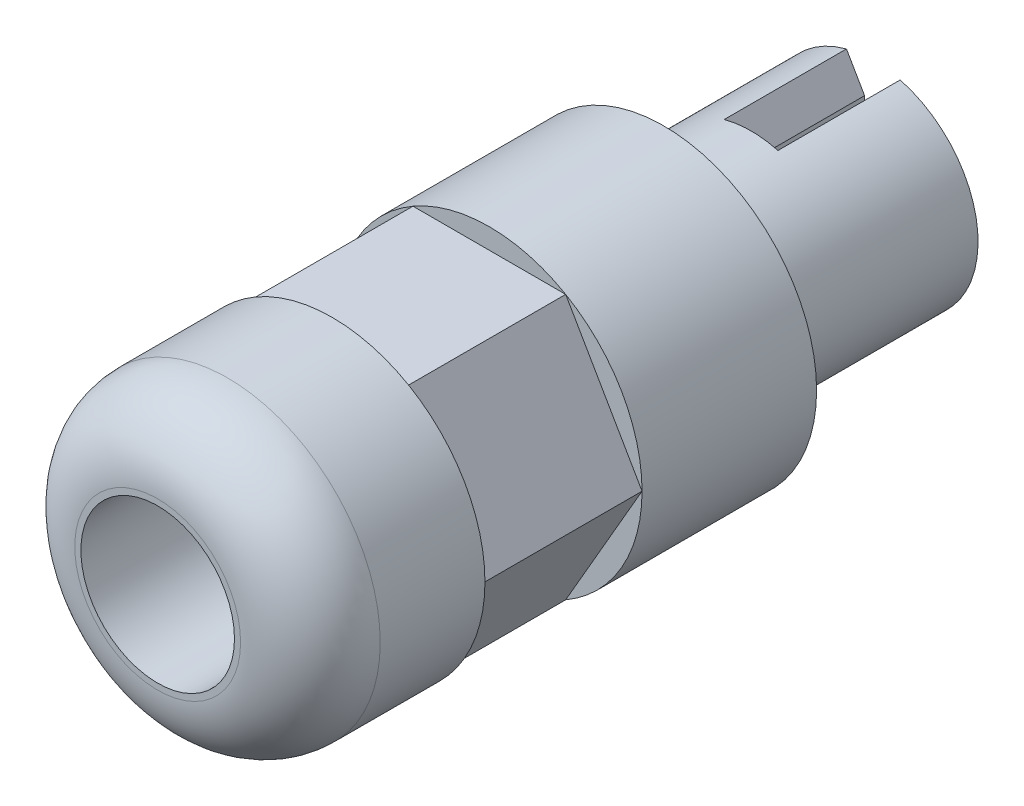
from build123d import *

# Parameters (mm, degrees)
SKETCH1_R           = 6
BOSS_EXTRUDE1_DEPTH = 12
SKETCH2_R           = 8.75
BOSS_EXTRUDE2_DEPTH = 10
BOSS_EXTRUDE3_DEPTH = 9
SKETCH4_R           = 8.75
BOSS_EXTRUDE4_DEPTH = 10
FILLET1_R           = 4
SKETCH5_R           = 4.4
CUT_EXTRUDE1_DEPTH  = 20
CUT_EXTRUDE2_DEPTH  = 7
SKETCH7_R           = 1
CUT_EXTRUDE3_DEPTH  = 7
CHAMFER1_SIZE       = 0.2


with BuildPart() as part:
    # Sketch1 → Boss-Extrude1 (new body)
    with BuildSketch(Plane.XY):
        Circle(SKETCH1_R)
    extrude(amount=BOSS_EXTRUDE1_DEPTH)

    # Sketch2 → Boss-Extrude2 (add)
    with BuildSketch(Plane.XY.offset(12)):
        Circle(SKETCH2_R)
    extrude(amount=BOSS_EXTRUDE2_DEPTH)

    # Sketch3 → Boss-Extrude3 (add)
    with BuildSketch(Plane.XY.offset(22)):
        Polygon((4.375, 7.577722283), (-4.375, 7.577722283), (-8.75, 0), (-4.375, -7.577722283), (4.375, -7.577722283), (8.75, 0), align=None)
    extrude(amount=BOSS_EXTRUDE3_DEPTH)

    # Sketch4 → Boss-Extrude4 (add)
    with BuildSketch(Plane.XY.offset(31)):
        Circle(SKETCH4_R)
    extrude(amount=BOSS_EXTRUDE4_DEPTH)

    # Fillet1
    fillet1_edges = [part.edges().sort_by_distance(p)[0] for p in [
        (-8.75, 0, 41),
    ]]
    fillet(fillet1_edges, radius=FILLET1_R)

    # Sketch5 → Cut-Extrude1 (cut)
    with BuildSketch(Plane.XY.offset(41)):
        Circle(SKETCH5_R)
    extrude(amount=-CUT_EXTRUDE1_DEPTH, mode=Mode.SUBTRACT)

    # Sketch6 → Cut-Extrude2 (cut)
    with BuildSketch(Plane(origin=(0, 0, 0), x_dir=(-1, 0, 0), z_dir=(0, 0, -1))):
        with BuildLine():
            Line((-0.5, -5.979130372), (-0.5, 4))
            Line((-0.5, 4), (-1.538832081, 5.799309944))
            ThreePointArc((-1.538832081, 5.799309944), (0, 6), (1.538832081, 5.799309944))
            Line((1.538832081, 5.799309944), (0.5, 4))
            Line((0.5, 4), (0.5, -5.979130372))
            ThreePointArc((0.5, -5.979130372), (0, -6), (-0.5, -5.979130372))
        make_face()
    extrude(amount=-CUT_EXTRUDE2_DEPTH, mode=Mode.SUBTRACT)

    # Sketch7 → Cut-Extrude3 (cut)
    with BuildSketch(Plane(origin=(0, 0, 0), x_dir=(-1, 0, 0), z_dir=(0, 0, -1))):
        with Locations((-2.5, 0)):
            Circle(SKETCH7_R)
        with Locations((2.5, 0)):
            Circle(SKETCH7_R)
    extrude(amount=-CUT_EXTRUDE3_DEPTH, mode=Mode.SUBTRACT)

    # Chamfer1
    chamfer1_edges = [part.edges().sort_by_distance(p)[0] for p in [
        (3.5, 0, 0),
        (-1.5, 0, 0),
    ]]
    chamfer(chamfer1_edges, length=CHAMFER1_SIZE)


solid = part.part
